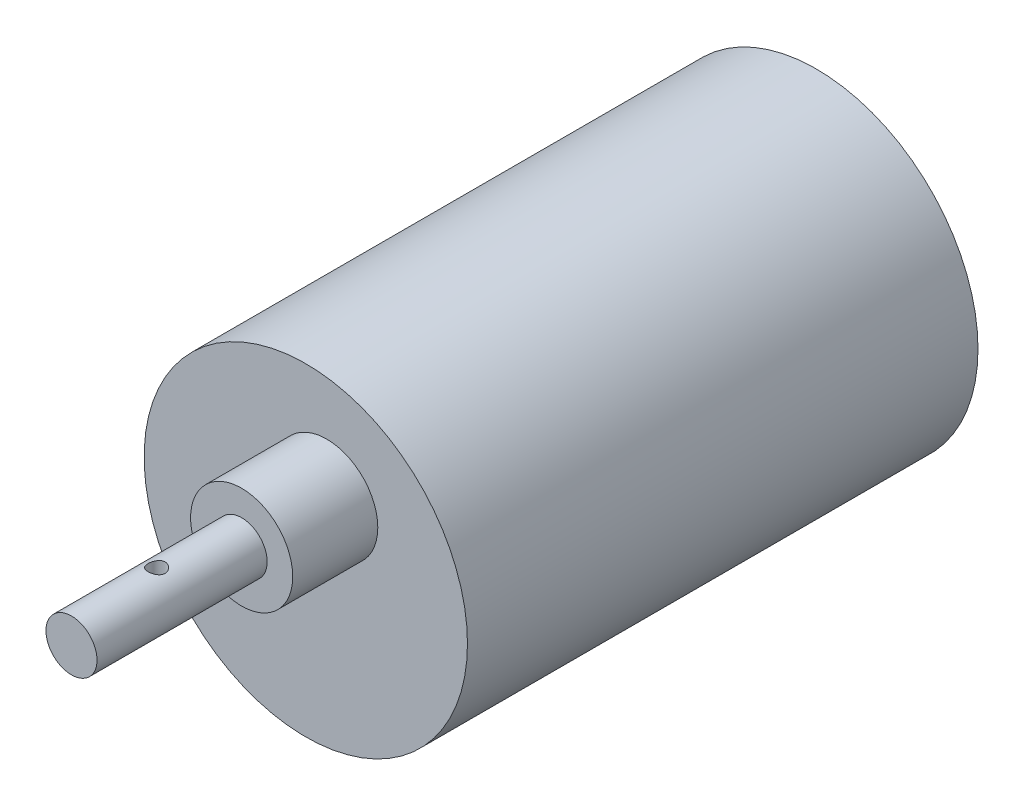
from build123d import *

# Parameters (mm, degrees)
SKETCH1_R             = 19
MOTOR_MACHINERY_DEPTH = 60
SKETCH2_R             = 6
BOSS_EXTRUDE2_DEPTH   = 10
SKETCH5_R             = 3
MOTOR_SHAFT_DEPTH     = 20
SKETCH7_R             = 1
HUB_HOLES_DEPTH       = 20


with BuildPart() as part:
    # Sketch1 → motor machinery (new body)
    with BuildSketch(Plane.XY):
        Circle(SKETCH1_R)
    extrude(amount=MOTOR_MACHINERY_DEPTH)

    # Sketch2 → Boss-Extrude2 (add)
    with BuildSketch(Plane.XY.offset(60)):
        with Locations((2.459603008, 6.553651886)):
            Circle(SKETCH2_R)
    extrude(amount=BOSS_EXTRUDE2_DEPTH)

    # Sketch5 → motor shaft (add)
    with BuildSketch(Plane.XY.offset(70)):
        with Locations((2.459603008, 6.553651886)):
            Circle(SKETCH5_R)
    extrude(amount=MOTOR_SHAFT_DEPTH)

    # Sketch7 → hub holes (cut)
    with BuildSketch(Plane(origin=(0, 0, 0), x_dir=(1, 0, 0), z_dir=(0, 1, 0))):
        with Locations(Location((2.459603008, -80, 0), (0, 0, 90))):
            Circle(SKETCH7_R)
    extrude(amount=HUB_HOLES_DEPTH, mode=Mode.SUBTRACT)


solid = part.part
